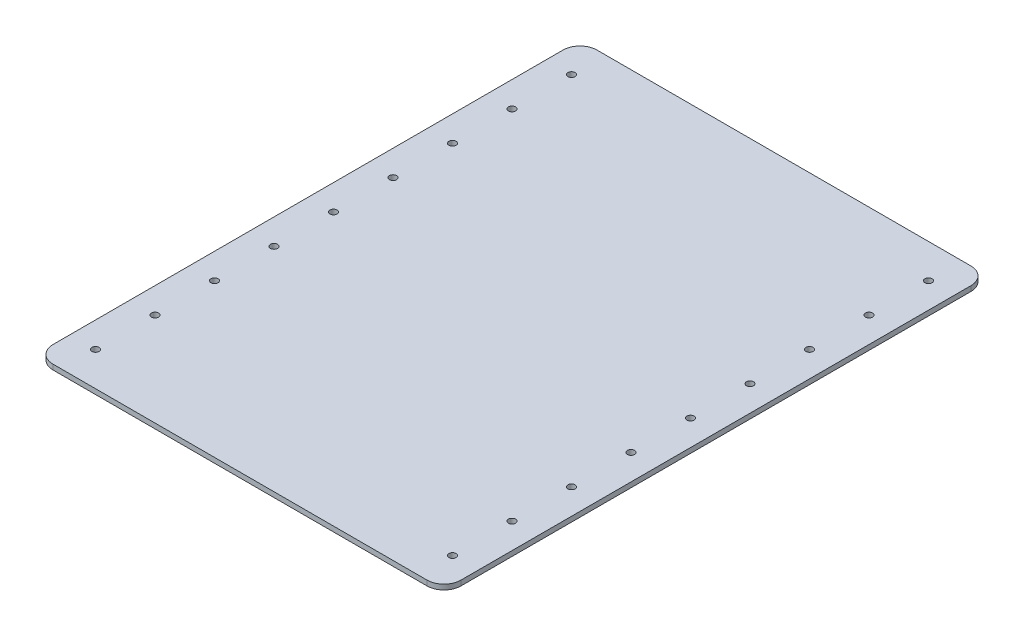
from build123d import *

# Parameters (mm, degrees)
SKETCH_1_W          = 240
SKETCH_1_H          = 320
EXTRUDE_1_DEPTH     = 3
FILLET_1_R          = 10
SKETCH_2_R          = 2.1
CUT_EXTRUDE_1_DEPTH = 3


with BuildPart() as part:
    # 草图1 → 凸台-拉伸1 (new body)
    with BuildSketch(Plane(origin=(0, 0, 0), x_dir=(1, 0, 0), z_dir=(0, 1, 0))):
        Rectangle(SKETCH_1_W, SKETCH_1_H)
    extrude(amount=EXTRUDE_1_DEPTH)

    # 圆角1
    fillet_1_edges = [part.edges().sort_by_distance(p)[0] for p in [
        (120, 1.5, 160),
        (-120, 1.5, 160),
        (-120, 1.5, -160),
        (120, 1.5, -160),
    ]]
    fillet(fillet_1_edges, radius=FILLET_1_R)

    # 草图2 → 切除-拉伸1 (cut)
    with BuildSketch(Plane(origin=(0, 3, 0), x_dir=(1, 0, 0), z_dir=(0, 1, 0))):
        with Locations(Location((-105, 140, 0), (0, 0, 270))):
            Circle(SKETCH_2_R)
        with Locations(Location((-105, 105, 0), (0, 0, 270))):
            Circle(SKETCH_2_R)
        with Locations(Location((-105, 70, 0), (0, 0, 270))):
            Circle(SKETCH_2_R)
        with Locations(Location((-105, 35, 0), (0, 0, 270))):
            Circle(SKETCH_2_R)
        with Locations(Location((-105, 0, 0), (0, 0, 270))):
            Circle(SKETCH_2_R)
        with Locations(Location((-105, -35, 0), (0, 0, 270))):
            Circle(SKETCH_2_R)
        with Locations(Location((-105, -70, 0), (0, 0, 270))):
            Circle(SKETCH_2_R)
        with Locations(Location((-105, -105, 0), (0, 0, 270))):
            Circle(SKETCH_2_R)
        with Locations(Location((-105, -140, 0), (0, 0, 270))):
            Circle(SKETCH_2_R)
        with Locations(Location((105, -140, 0), (0, 0, 90))):
            Circle(SKETCH_2_R)
        with Locations(Location((105, -105, 0), (0, 0, 90))):
            Circle(SKETCH_2_R)
        with Locations(Location((105, -70, 0), (0, 0, 90))):
            Circle(SKETCH_2_R)
        with Locations(Location((105, -35, 0), (0, 0, 90))):
            Circle(SKETCH_2_R)
        with Locations(Location((105, 0, 0), (0, 0, 90))):
            Circle(SKETCH_2_R)
        with Locations(Location((105, 35, 0), (0, 0, 90))):
            Circle(SKETCH_2_R)
        with Locations(Location((105, 70, 0), (0, 0, 90))):
            Circle(SKETCH_2_R)
        with Locations(Location((105, 105, 0), (0, 0, 90))):
            Circle(SKETCH_2_R)
        with Locations(Location((105, 140, 0), (0, 0, 90))):
            Circle(SKETCH_2_R)
    extrude(amount=-CUT_EXTRUDE_1_DEPTH, mode=Mode.SUBTRACT)


solid = part.part
